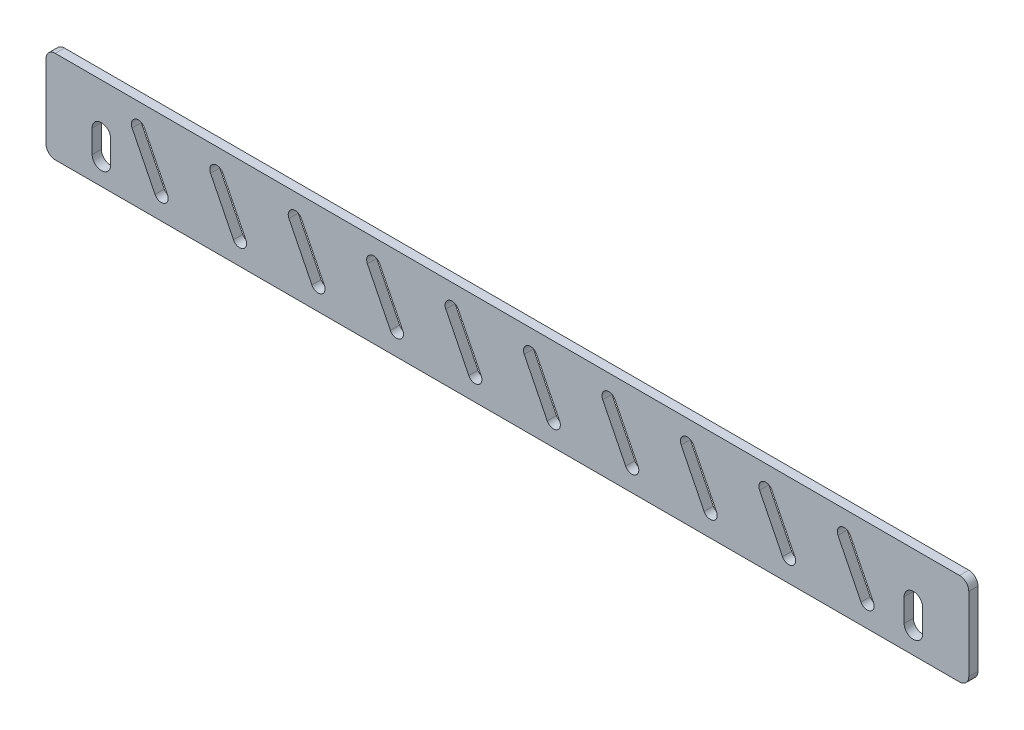
from build123d import *

# Parameters (mm, degrees)
SKETCH1_W           = 200
SKETCH1_H           = 20
BOSS_EXTRUDE1_DEPTH = 2
FILLET1_R           = 2
CUT_EXTRUDE1_DEPTH  = 101.518654985
CUT_EXTRUDE2_DEPTH  = 10


with BuildPart() as part:
    # Sketch1 → Boss-Extrude1 (new body)
    with BuildSketch(Plane.XY):
        Rectangle(SKETCH1_W, SKETCH1_H)
    extrude(amount=BOSS_EXTRUDE1_DEPTH)

    # Fillet1
    fillet1_edges = [part.edges().sort_by_distance(p)[0] for p in [
        (100, -10, 1),
        (-100, -10, 1),
        (-100, 10, 1),
        (100, 10, 1),
    ]]
    fillet(fillet1_edges, radius=FILLET1_R)

    # Sketch2 → Cut-Extrude1 (cut, through all)
    with BuildSketch(Plane.XY.offset(2)):
        with BuildLine():
            Line((-85.99, 0), (-85.99, -5))
            ThreePointArc((-85.99, -5), (-87.995, -7.005), (-90, -5))
            Line((-90, -5), (-90, 0))
            ThreePointArc((-90, 0), (-87.995, 2.005), (-85.99, 0))
        make_face()
        with BuildLine():
            Line((85.99, 0), (85.99, -5))
            ThreePointArc((85.99, -5), (87.995, -7.005), (90, -5))
            Line((90, -5), (90, 0))
            ThreePointArc((90, 0), (87.995, 2.005), (85.99, 0))
        make_face()
    extrude(amount=-CUT_EXTRUDE1_DEPTH, mode=Mode.SUBTRACT)

    # Sketch3 → Cut-Extrude2 (cut)
    with BuildSketch(Plane.XY.offset(2)):
        with BuildLine():
            Line((-78.657225294, 5.668547746), (-73.678372606, -4.331452254))
            ThreePointArc((-73.678372606, -4.331452254), (-74.352599567, -6.342774706), (-76.363922019, -5.668547746))
            Line((-76.363922019, -5.668547746), (-81.342774706, 4.331452254))
            ThreePointArc((-81.342774706, 4.331452254), (-80.668547746, 6.342774706), (-78.657225294, 5.668547746))
        make_face()
        with BuildLine():
            Line((-61.657225294, 5.668547746), (-56.678372606, -4.331452254))
            ThreePointArc((-56.678372606, -4.331452254), (-57.352599567, -6.342774706), (-59.363922019, -5.668547746))
            Line((-59.363922019, -5.668547746), (-64.342774706, 4.331452254))
            ThreePointArc((-64.342774706, 4.331452254), (-63.668547746, 6.342774706), (-61.657225294, 5.668547746))
        make_face()
        with BuildLine():
            Line((-44.657225294, 5.668547746), (-39.678372606, -4.331452254))
            ThreePointArc((-39.678372606, -4.331452254), (-40.352599567, -6.342774706), (-42.363922019, -5.668547746))
            Line((-42.363922019, -5.668547746), (-47.342774706, 4.331452254))
            ThreePointArc((-47.342774706, 4.331452254), (-46.668547746, 6.342774706), (-44.657225294, 5.668547746))
        make_face()
        with BuildLine():
            Line((-27.657225294, 5.668547746), (-22.678372606, -4.331452254))
            ThreePointArc((-22.678372606, -4.331452254), (-23.352599567, -6.342774706), (-25.363922019, -5.668547746))
            Line((-25.363922019, -5.668547746), (-30.342774706, 4.331452254))
            ThreePointArc((-30.342774706, 4.331452254), (-29.668547746, 6.342774706), (-27.657225294, 5.668547746))
        make_face()
        with BuildLine():
            Line((-10.657225294, 5.668547746), (-5.678372606, -4.331452254))
            ThreePointArc((-5.678372606, -4.331452254), (-6.352599567, -6.342774706), (-8.363922019, -5.668547746))
            Line((-8.363922019, -5.668547746), (-13.342774706, 4.331452254))
            ThreePointArc((-13.342774706, 4.331452254), (-12.668547746, 6.342774706), (-10.657225294, 5.668547746))
        make_face()
        with BuildLine():
            Line((6.342774706, 5.668547746), (11.321627394, -4.331452254))
            ThreePointArc((11.321627394, -4.331452254), (10.647400433, -6.342774706), (8.636077981, -5.668547746))
            Line((8.636077981, -5.668547746), (3.657225294, 4.331452254))
            ThreePointArc((3.657225294, 4.331452254), (4.331452254, 6.342774706), (6.342774706, 5.668547746))
        make_face()
        with BuildLine():
            Line((23.342774706, 5.668547746), (28.321627394, -4.331452254))
            ThreePointArc((28.321627394, -4.331452254), (27.647400433, -6.342774706), (25.636077981, -5.668547746))
            Line((25.636077981, -5.668547746), (20.657225294, 4.331452254))
            ThreePointArc((20.657225294, 4.331452254), (21.331452254, 6.342774706), (23.342774706, 5.668547746))
        make_face()
        with BuildLine():
            Line((40.342774706, 5.668547746), (45.321627394, -4.331452254))
            ThreePointArc((45.321627394, -4.331452254), (44.647400433, -6.342774706), (42.636077981, -5.668547746))
            Line((42.636077981, -5.668547746), (37.657225294, 4.331452254))
            ThreePointArc((37.657225294, 4.331452254), (38.331452254, 6.342774706), (40.342774706, 5.668547746))
        make_face()
        with BuildLine():
            Line((57.342774706, 5.668547746), (62.321627394, -4.331452254))
            ThreePointArc((62.321627394, -4.331452254), (61.647400433, -6.342774706), (59.636077981, -5.668547746))
            Line((59.636077981, -5.668547746), (54.657225294, 4.331452254))
            ThreePointArc((54.657225294, 4.331452254), (55.331452254, 6.342774706), (57.342774706, 5.668547746))
        make_face()
        with BuildLine():
            Line((74.342774706, 5.668547746), (79.321627394, -4.331452254))
            ThreePointArc((79.321627394, -4.331452254), (78.647400433, -6.342774706), (76.636077981, -5.668547746))
            Line((76.636077981, -5.668547746), (71.657225294, 4.331452254))
            ThreePointArc((71.657225294, 4.331452254), (72.331452254, 6.342774706), (74.342774706, 5.668547746))
        make_face()
    extrude(amount=-CUT_EXTRUDE2_DEPTH, mode=Mode.SUBTRACT)


solid = part.part
